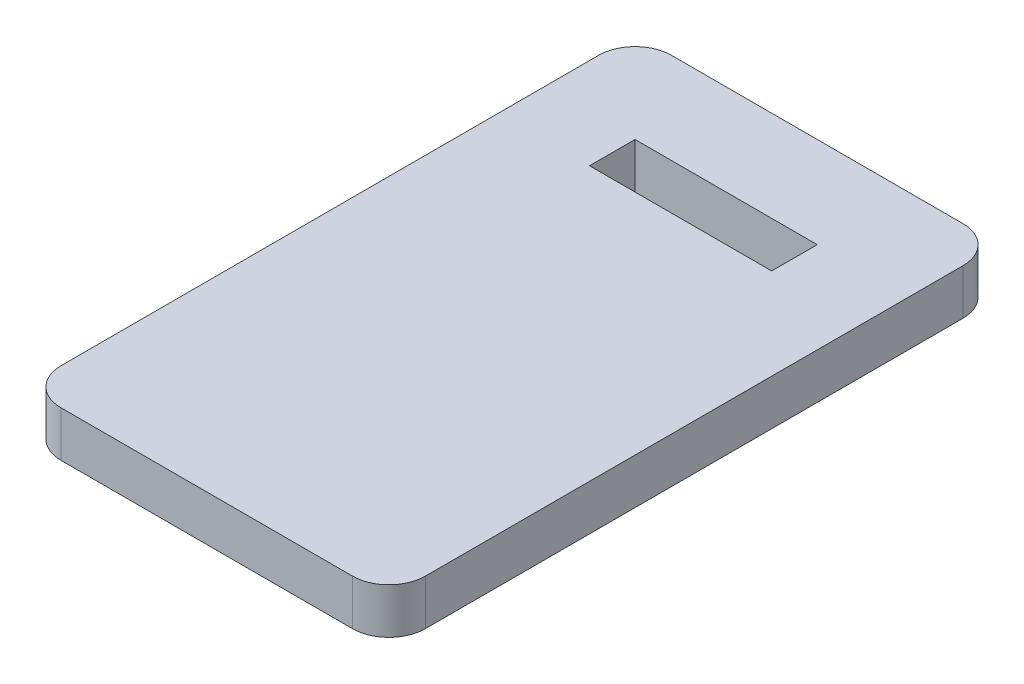
from build123d import *

# Parameters (mm, degrees)
SKETCH1_W           = 25.4
SKETCH1_H           = 42.555
BOSS_EXTRUDE1_DEPTH = 3.175
SKETCH2_W           = 12.7
SKETCH2_H           = 3.175
CUT_EXTRUDE1_DEPTH  = 50.660534129
FILLET1_R           = 2.54


with BuildPart() as part:
    # Sketch1 → Boss-Extrude1 (new body)
    with BuildSketch(Plane(origin=(0, 0, 0), x_dir=(1, 0, 0), z_dir=(0, 1, 0))):
        with Locations((12.7, 21.2775)):
            Rectangle(SKETCH1_W, SKETCH1_H)
    extrude(amount=BOSS_EXTRUDE1_DEPTH)

    # Sketch2 → Cut-Extrude1 (cut, through all)
    with BuildSketch(Plane(origin=(0, 3.175, 0), x_dir=(1, 0, 0), z_dir=(0, 1, 0))):
        with Locations((12.7, 34.6175)):
            Rectangle(SKETCH2_W, SKETCH2_H)
    extrude(amount=-CUT_EXTRUDE1_DEPTH, mode=Mode.SUBTRACT)

    # Fillet1
    fillet1_edges = [part.edges().sort_by_distance(p)[0] for p in [
        (0, 1.5875, -42.555),
        (25.4, 1.5875, -42.555),
        (25.4, 1.5875, 0),
        (0, 1.5875, 0),
    ]]
    fillet(fillet1_edges, radius=FILLET1_R)


solid = part.part
